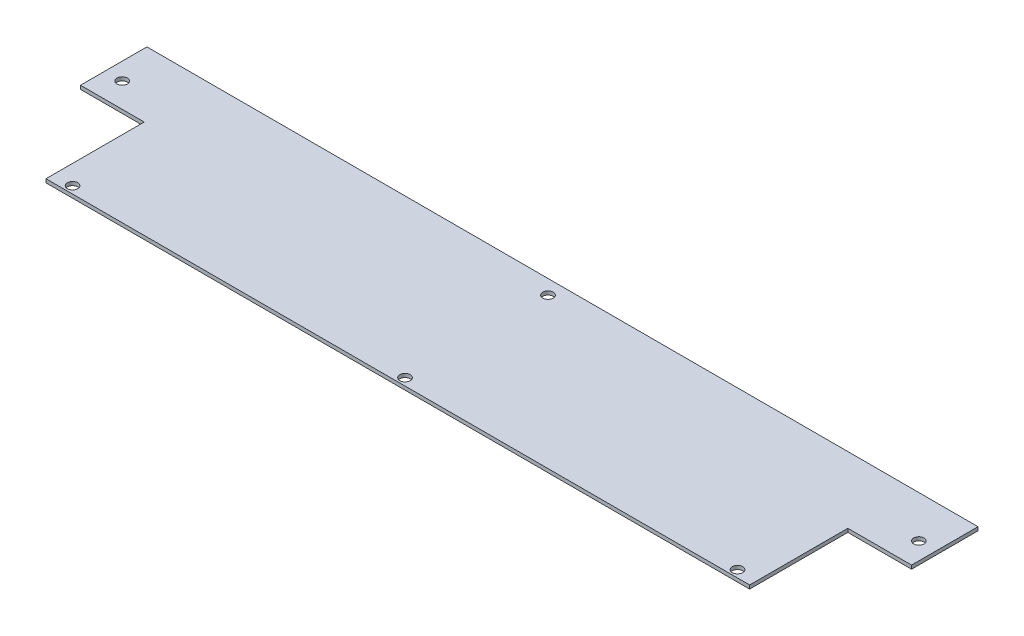
from build123d import *

# Parameters (mm, degrees)
SKETCH1_R           = 2.286
BOSS_EXTRUDE1_DEPTH = 1.5875


with BuildPart() as part:
    # Sketch1 → Boss-Extrude1 (new body)
    with BuildSketch(Plane(origin=(0, 0, 0), x_dir=(1, 0, 0), z_dir=(0, 1, 0))):
        Polygon((-154.686, -36.195), (-154.686, 6.985), (-182.708271591, 6.985), (-182.708271591, 36.195), (182.708271591, 36.195), (182.708271591, 6.985), (154.686, 6.985), (154.686, -36.195), align=None)
        with Locations(Location((175.1457, 17.78, 0), (0, 0, 270))):
            Circle(SKETCH1_R, mode=Mode.SUBTRACT)
        with Locations(Location((0, 29.845, 0), (0, 0, 270))):
            Circle(SKETCH1_R, mode=Mode.SUBTRACT)
        with Locations(Location((146.177, -33.02, 0), (0, 0, 270))):
            Circle(SKETCH1_R, mode=Mode.SUBTRACT)
        with Locations(Location((-175.1457, 17.78, 0), (0, 0, 270))):
            Circle(SKETCH1_R, mode=Mode.SUBTRACT)
        with Locations(Location((0, -33.02, 0), (0, 0, 270))):
            Circle(SKETCH1_R, mode=Mode.SUBTRACT)
        with Locations(Location((-146.177, -33.02, 0), (0, 0, 270))):
            Circle(SKETCH1_R, mode=Mode.SUBTRACT)
    extrude(amount=BOSS_EXTRUDE1_DEPTH)


solid = part.part
